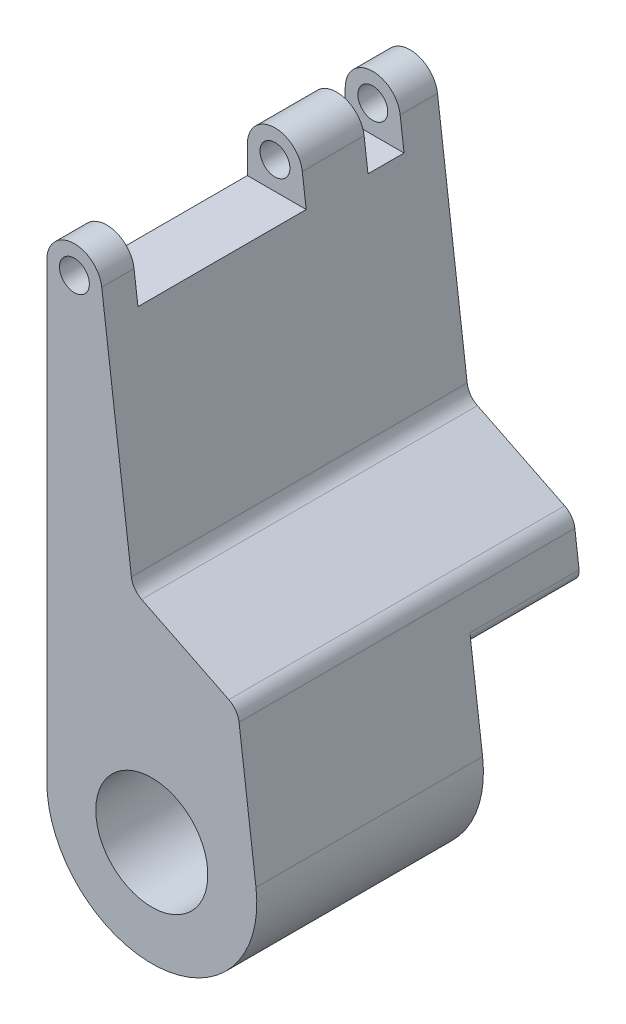
from build123d import *

# Parameters (mm, degrees)
EXTRUDE1_DEPTH = 15.407108717
EXTRUDE2_START = 7.422870335
EXTRUDE2_DEPTH = 7.422870335
SKETCH3_R      = 3.81
EXTRUDE3_DEPTH = 37.782065936
SKETCH4_R      = 1.016
EXTRUDE4_DEPTH = 41.456758632
SKETCH6_W      = 2.451904957
SKETCH6_H      = 3.748582847
SKETCH6_W_2    = 11.438391631
EXTRUDE6_DEPTH = 39.80458612


with BuildPart() as part:
    # Sketch1 → Extrude1 (new body)
    with BuildSketch(Plane.XY):
        with BuildLine():
            Line((-7.138522943, 30.753654662), (-7.138522943, 0))
            ThreePointArc((-7.138522943, 0), (0.445823167, -7.124587813), (7.08283683, 0.889905749))
            Line((7.08283683, 0.889905749), (5.932301807, 10.047113518))
            ThreePointArc((5.932301807, 10.047113518), (5.707297096, 10.62465377), (5.235742646, 11.026917691))
            Line((5.235742646, 11.026917691), (-0.692002916, 13.961994048))
            ThreePointArc((-0.692002916, 13.961994048), (-1.163557366, 14.364257969), (-1.388562077, 14.941798222))
            Line((-1.388562077, 14.941798222), (-3.404561048, 30.987308419))
            ThreePointArc((-3.404561048, 30.987308419), (-5.381286902, 32.624287275), (-7.138522943, 30.753654662))
        make_face()
    extrude(amount=EXTRUDE1_DEPTH)

    # Sketch2 → Extrude2 (add)
    with BuildSketch(Plane(origin=(0, 0, 0), x_dir=(-1, 0, 0), z_dir=(0, 0, -1)).offset(EXTRUDE2_START)):
        with BuildLine():
            Line((1.388562077, 14.941798222), (3.404561048, 30.987308419))
            ThreePointArc((3.404561048, 30.987308419), (5.381286902, 32.624287275), (7.138522943, 30.753654662))
            Line((7.138522943, 30.753654662), (7.138522943, 8.467771223))
            ThreePointArc((7.138522943, 8.467771223), (6.680781174, 7.362684837), (5.575694788, 6.904943069))
            Line((5.575694788, 6.904943069), (-5.473496233, 6.904943069))
            ThreePointArc((-5.473496233, 6.904943069), (-6.038205752, 7.159804295), (-6.220680789, 7.751880259))
            Line((-6.220680789, 7.751880259), (-5.932301807, 10.047113518))
            ThreePointArc((-5.932301807, 10.047113518), (-5.707297096, 10.62465377), (-5.235742646, 11.026917691))
            Line((-5.235742646, 11.026917691), (0.692002916, 13.961994048))
            ThreePointArc((0.692002916, 13.961994048), (1.163557366, 14.364257969), (1.388562077, 14.941798222))
        make_face()
    extrude(amount=-EXTRUDE2_DEPTH)

    # Sketch3 → Extrude3 (cut, through all)
    with BuildSketch(Plane(origin=(0, 0, 0), x_dir=(-1, 0, 0), z_dir=(0, 0, -1))):
        Circle(SKETCH3_R)
    extrude(amount=-EXTRUDE3_DEPTH, mode=Mode.SUBTRACT)

    # Sketch4 → Extrude4 (cut, through all)
    with BuildSketch(Plane(origin=(0, 0, -7.422870335), x_dir=(-1, 0, 0), z_dir=(0, 0, -1))):
        with Locations((5.264231519, 30.753654662)):
            Circle(SKETCH4_R)
    extrude(amount=-EXTRUDE4_DEPTH, mode=Mode.SUBTRACT)

    # Sketch6 → Extrude6 (cut, through all)
    with BuildSketch(Plane.ZY.offset(7.138522943)):
        with Locations((-3.656917857, 30.753654662)):
            Rectangle(SKETCH6_W, SKETCH6_H)
        with Locations((7.490088589, 30.753654662)):
            Rectangle(SKETCH6_W_2, SKETCH6_H)
    extrude(amount=-EXTRUDE6_DEPTH, mode=Mode.SUBTRACT)


solid = part.part
